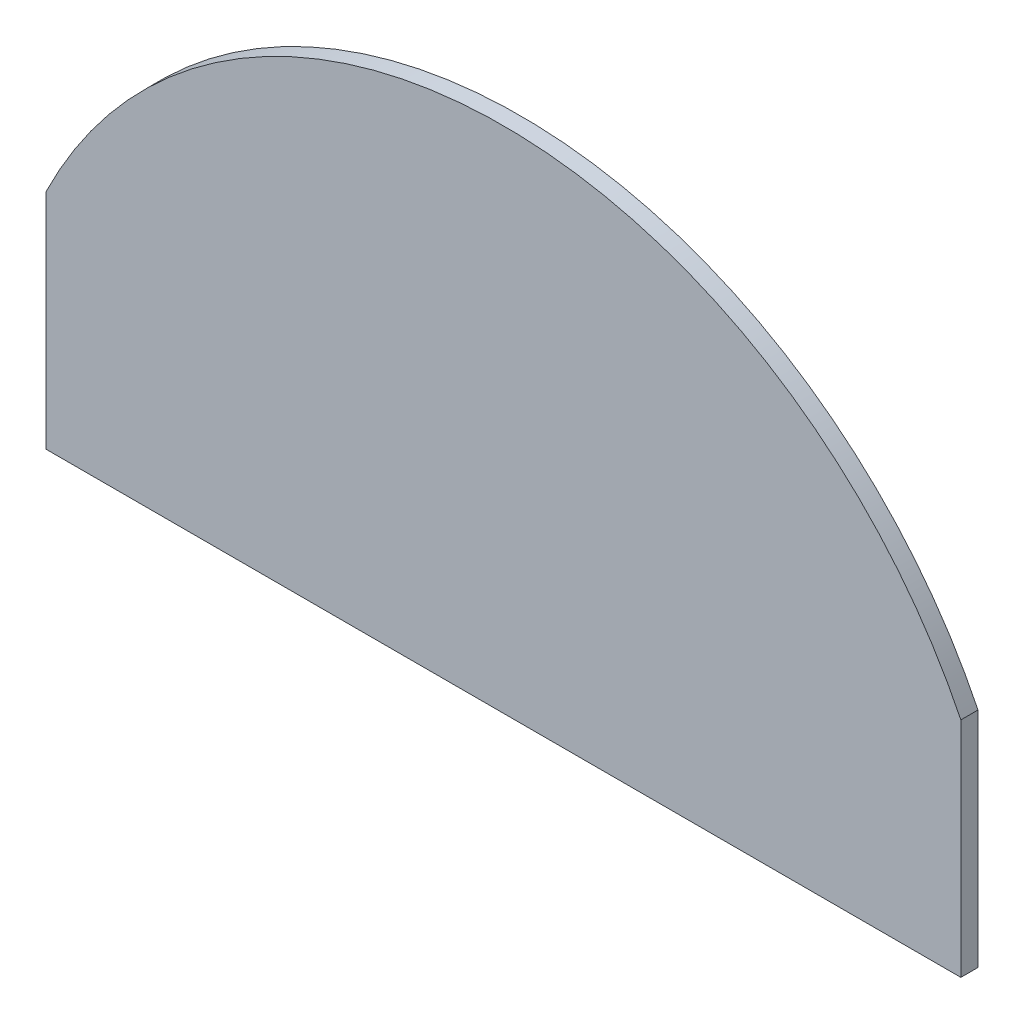
from build123d import *

# Parameters (mm, degrees)
BOSS_EXTRUDE1_DEPTH = 3


with BuildPart() as part:
    # Sketch1 → Boss-Extrude1 (new body)
    with BuildSketch(Plane.XY):
        with BuildLine():
            Line((160, 0), (160, -39))
            Line((160, -39), (0, -39))
            Line((0, -39), (0, 0))
            ThreePointArc((0, 0), (80, 50), (160, 0))
        make_face()
    extrude(amount=BOSS_EXTRUDE1_DEPTH)


solid = part.part
